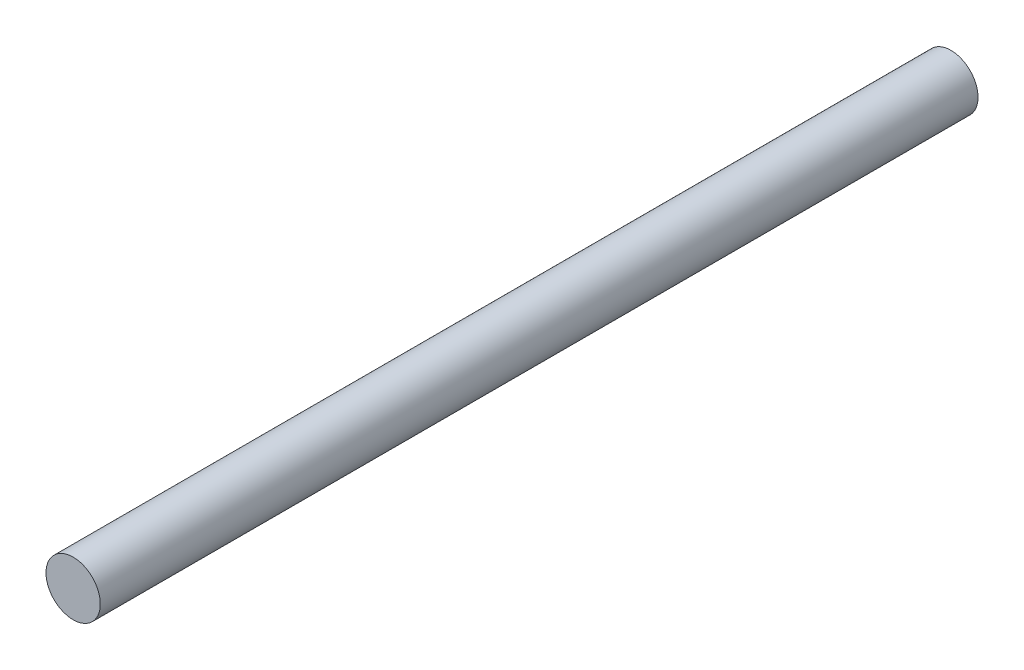
from build123d import *

# Parameters (mm, degrees)
SKETCH1_R           = 3
BOSS_EXTRUDE1_DEPTH = 97


with BuildPart() as part:
    # Sketch1 → Boss-Extrude1 (new body)
    with BuildSketch(Plane.XY):
        with Locations(Location((0, 0, 0), (0, 0, 180))):
            Circle(SKETCH1_R)
    extrude(amount=BOSS_EXTRUDE1_DEPTH)


solid = part.part
